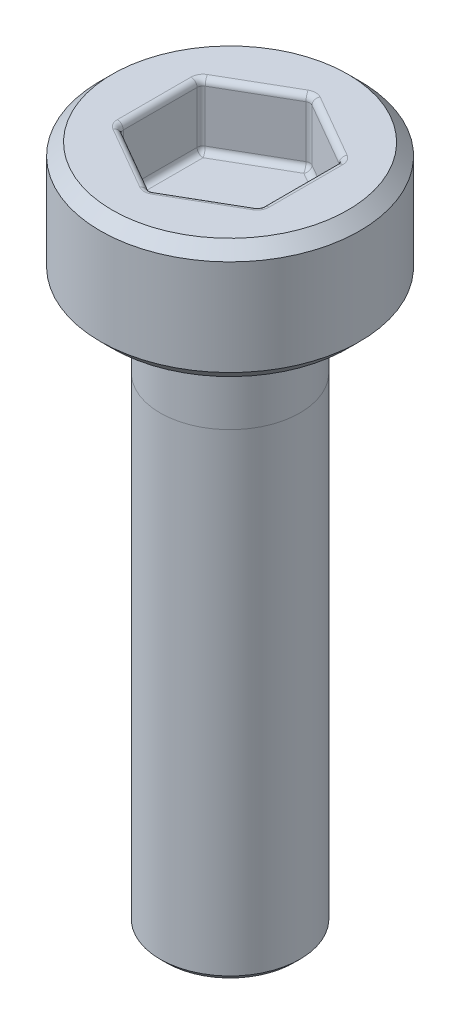
from build123d import *

# Parameters (mm, degrees)
SKETCH1_R           = 0.875
BOSS_EXTRUDE1_DEPTH = 7
SKETCH2_R           = 1.625
BOSS_EXTRUDE2_DEPTH = 1.5
FILLET1_R           = 0.15
CHAMFER1_SIZE       = 0.15
CUT_EXTRUDE1_DEPTH  = 0.8
CHAMFER2_SIZE       = 0.075
FILLET2_R           = 0.075


with BuildPart() as part:
    # Sketch1 → Boss-Extrude1 (new body)
    with BuildSketch(Plane(origin=(0, 0, 0), x_dir=(1, 0, 0), z_dir=(0, 1, 0))):
        with Locations(Location((0, 0, 0), (0, 0, 270))):
            Circle(SKETCH1_R)
    extrude(amount=BOSS_EXTRUDE1_DEPTH)

    # Sketch2 → Boss-Extrude2 (add)
    with BuildSketch(Plane(origin=(0, 7, 0), x_dir=(1, 0, 0), z_dir=(0, 1, 0))):
        with Locations(Location((0, 0, 0), (0, 0, 270))):
            Circle(SKETCH2_R)
    extrude(amount=BOSS_EXTRUDE2_DEPTH)

    # Fillet1
    fillet1_edges = [part.edges().sort_by_distance(p)[0] for p in [
        (0, 7, -0.875),
    ]]
    fillet(fillet1_edges, radius=FILLET1_R)

    # Chamfer1
    chamfer1_edges = [part.edges().sort_by_distance(p)[0] for p in [
        (0, 7, -1.625),
        (0, 8.5, -1.625),
    ]]
    chamfer(chamfer1_edges, length=CHAMFER1_SIZE)

    # Sketch3 → Cut-Extrude1 (cut)
    with BuildSketch(Plane(origin=(0, 8.5, 0), x_dir=(1, 0, 0), z_dir=(0, 1, 0))):
        Polygon((0, 1.010362971), (-0.875, 0.505181486), (-0.875, -0.505181486), (0, -1.010362971), (0.875, -0.505181486), (0.875, 0.505181486), align=None)
    extrude(amount=-CUT_EXTRUDE1_DEPTH, mode=Mode.SUBTRACT)

    # Chamfer2
    chamfer2_edges = [part.edges().sort_by_distance(p)[0] for p in [
        (0, 0, -0.875),
    ]]
    chamfer(chamfer2_edges, length=CHAMFER2_SIZE)

    # Fillet2
    fillet2_edges = [part.edges().sort_by_distance(p)[0] for p in [
        (0.4375, 7.7, -0.757772228),
        (0, 8.1, -1.010362971),
        (0.875, 7.7, 0),
        (0.875, 8.1, -0.505181486),
        (0.4375, 7.7, 0.757772228),
        (0.875, 8.1, 0.505181486),
        (-0.4375, 7.7, 0.757772228),
        (0, 8.1, 1.010362971),
        (-0.875, 7.7, 0),
        (-0.875, 8.1, 0.505181486),
        (-0.4375, 7.7, -0.757772228),
        (-0.875, 8.1, -0.505181486),
        (0.4375, 8.5, -0.757772228),
        (-0.4375, 8.5, -0.757772228),
        (-0.875, 8.5, 0),
        (-0.4375, 8.5, 0.757772228),
        (0.4375, 8.5, 0.757772228),
        (0.875, 8.5, 0),
    ]]
    fillet(fillet2_edges, radius=FILLET2_R)


solid = part.part
